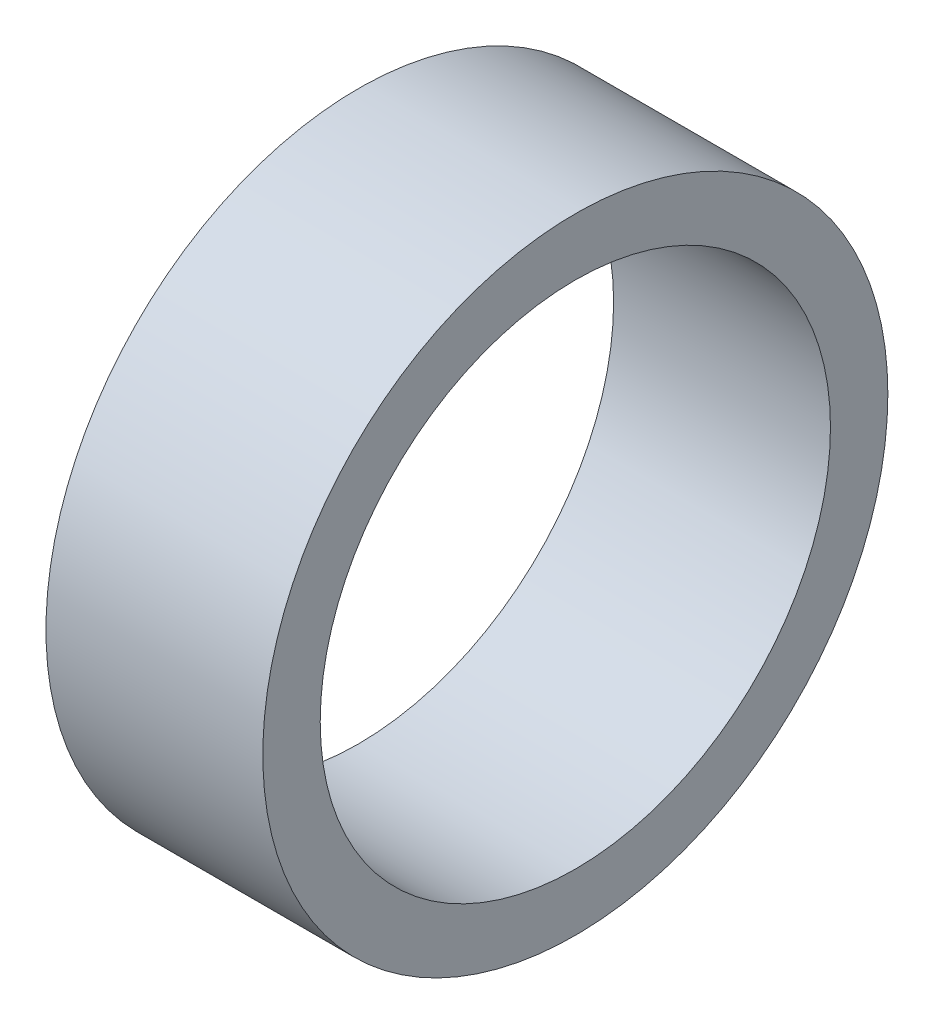
from build123d import *

# Parameters (mm, degrees)
SKETCH_1_R      = 12.25
SKETCH_1_R_2    = 10
EXTRUDE_1_DEPTH = 8.5


with BuildPart() as part:
    # ｽｹｯﾁ1 → ﾎﾞｽ - 押し出し1 (new body)
    with BuildSketch(Plane.YZ):
        with Locations(Location((0, 0, 0), (0, 0, 270))):
            Circle(SKETCH_1_R)
        with Locations(Location((0, 0, 0), (0, 0, 270))):
            Circle(SKETCH_1_R_2, mode=Mode.SUBTRACT)
    extrude(amount=EXTRUDE_1_DEPTH)


solid = part.part
